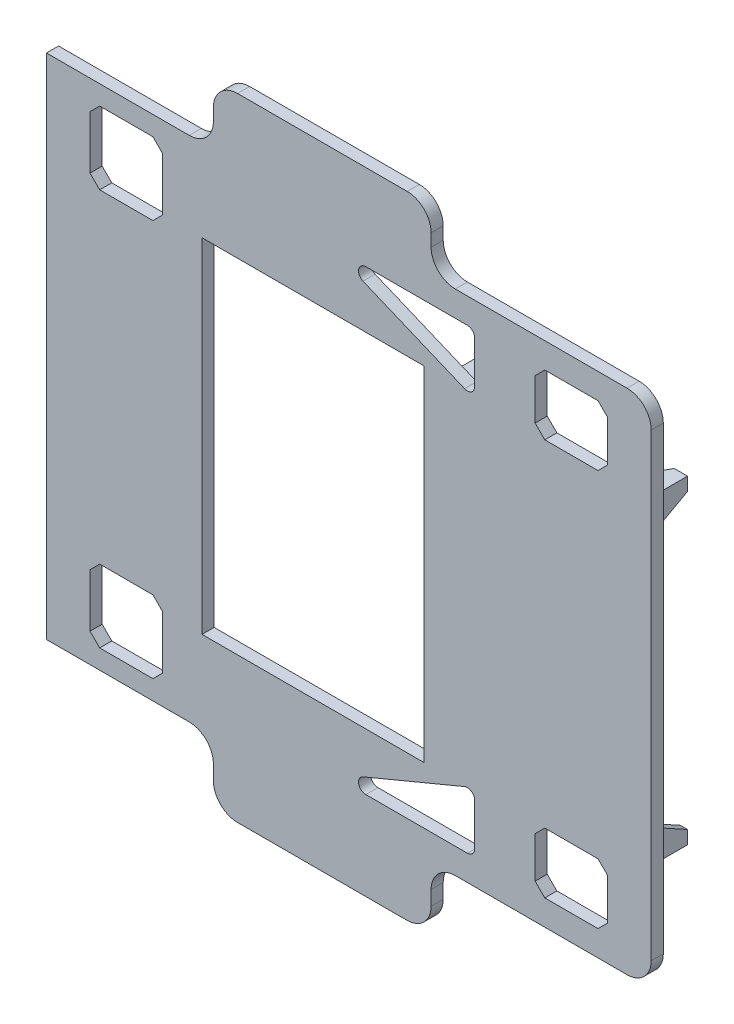
from build123d import *

# Parameters (mm, degrees)
EXTRUDE_1_DEPTH     = 5
SKETCH_2_W          = 30
SKETCH_2_H          = 30
SKETCH_2_H_2        = 25
CUT_EXTRUDE_1_DEPTH = 189.903823128
CHAMFER_1_SIZE      = 4
EXTRUDE_2_DEPTH     = 15
CUT_EXTRUDE_2_DEPTH = 3
CUT_EXTRUDE_3_DEPTH = 3
CUT_EXTRUDE_4_DEPTH = 3
CUT_EXTRUDE_5_DEPTH = 3
FILLET_1_R          = 3
SKETCH_8_W          = 91.7
SKETCH_8_H          = 142
CUT_EXTRUDE_6_DEPTH = 5


with BuildPart() as part:
    # 草图1 → 凸台-拉伸1 (new body)
    with BuildSketch(Plane.XY):
        with BuildLine():
            Line((-45, 115), (-45, 120))
            ThreePointArc((-45, 120), (-42.071067812, 127.071067812), (-35, 130))
            Line((-35, 130), (35.124730195, 130))
            ThreePointArc((35.124730195, 130), (42.10760044, 127.10760044), (45, 120.124730195))
            Line((45, 120.124730195), (45, 115))
            ThreePointArc((45, 115), (47.928932188, 107.928932188), (55, 105))
            Line((55, 105), (126, 105))
            ThreePointArc((126, 105), (133.071067812, 102.071067812), (136, 95))
            Line((136, 95), (136, -95))
            ThreePointArc((136, -95), (133.071067812, -102.071067812), (126, -105))
            Line((126, -105), (115, -105))
            Line((115, -105), (55, -105))
            ThreePointArc((55, -105), (47.928932188, -107.928932188), (45, -115))
            Line((45, -115), (45, -121.010130877))
            ThreePointArc((45, -121.010130877), (42.071067812, -128.081198689), (35, -131.010130877))
            Line((35, -131.010130877), (-35, -131.010130877))
            ThreePointArc((-35, -131.010130877), (-42.071067812, -128.081198689), (-45, -121.010130877))
            Line((-45, -121.010130877), (-45, -115))
            ThreePointArc((-45, -115), (-47.928932188, -107.928932188), (-55, -105))
            Line((-55, -105), (-114, -105))
            Line((-114, -105), (-114, -95))
            Line((-114, -95), (-114, 95))
            Line((-114, 95), (-114, 105))
            Line((-114, 105), (-55, 105))
            ThreePointArc((-55, 105), (-47.928932188, 107.928932188), (-45, 115))
        make_face()
    extrude(amount=EXTRUDE_1_DEPTH)

    # 草图2 → 切除-拉伸1 (cut, through all)
    with BuildSketch(Plane.XY.offset(5)):
        with Locations((-81, 82)):
            Rectangle(SKETCH_2_W, SKETCH_2_H)
        with Locations((-81, -82)):
            Rectangle(SKETCH_2_W, SKETCH_2_H)
        with Locations((103, 82)):
            Rectangle(SKETCH_2_W, SKETCH_2_H_2)
        with Locations((103, -82)):
            Rectangle(SKETCH_2_W, SKETCH_2_H_2)
        Polygon((3, 94.5), (63, 94.5), (63, 69.5), align=None)
        Polygon((3, -94.5), (63, -94.5), (63, -69.5), align=None)
    extrude(amount=-CUT_EXTRUDE_1_DEPTH, mode=Mode.SUBTRACT)

    # 倒角1
    chamfer_1_edges = [part.edges().sort_by_distance(p)[0] for p in [
        (118, -69.5, 2.5),
        (118, -94.5, 2.5),
        (88, -94.5, 2.5),
        (88, -69.5, 2.5),
        (118, 94.5, 2.5),
        (118, 69.5, 2.5),
        (88, 69.5, 2.5),
        (88, 94.5, 2.5),
        (-66, -67, 2.5),
        (-66, -97, 2.5),
        (-96, -97, 2.5),
        (-96, -67, 2.5),
        (-66, 97, 2.5),
        (-66, 67, 2.5),
        (-96, 67, 2.5),
        (-96, 97, 2.5),
    ]]
    chamfer(chamfer_1_edges, length=CHAMFER_1_SIZE)

    # 草图3 → 凸台-拉伸2 (add)
    with BuildSketch(Plane(origin=(0, 0, 0), x_dir=(-1, 0, 0), z_dir=(0, 0, -1))):
        Polygon((-131, 66), (-131, 55), (-128, 55), (-128, 63), (-120, 63), (-120, 66), align=None)
        Polygon((-56, 63), (-56, 66), (-45, 66), (-45, 55), (-48, 55), (-48, 63), align=None)
        Polygon((-48, -63), (-56, -63), (-56, -66), (-45, -66), (-45, -55), (-48, -55), align=None)
        Polygon((-120, -63), (-120, -66), (-131, -66), (-131, -55), (-128, -55), (-128, -63), align=None)
    extrude(amount=EXTRUDE_2_DEPTH)

    # 草图4 → 切除-拉伸2 (cut)
    with BuildSketch(Plane(origin=(131, 0, 0), x_dir=(0, 0, -1), z_dir=(1, 0, 0))):
        Polygon((15, 60.5), (5, 55), (15, 55), align=None)
        Polygon((15, -60.5), (15, -55), (5, -55), align=None)
    extrude(amount=-CUT_EXTRUDE_2_DEPTH, mode=Mode.SUBTRACT)

    # 草图5 → 切除-拉伸3 (cut)
    with BuildSketch(Plane(origin=(0, 66, 0), x_dir=(1, 0, 0), z_dir=(0, 1, 0))):
        Polygon((50.5, 15), (56, 15), (56, 5), align=None)
        Polygon((120, 15), (125.5, 15), (120, 5), align=None)
    extrude(amount=-CUT_EXTRUDE_3_DEPTH, mode=Mode.SUBTRACT)

    # 草图6 → 切除-拉伸4 (cut)
    with BuildSketch(Plane.ZY.offset(-45)):
        Polygon((-15, 60.5), (-5, 55), (-15, 55), align=None)
        Polygon((-15, -60.5), (-15, -55), (-5, -55), align=None)
    extrude(amount=-CUT_EXTRUDE_4_DEPTH, mode=Mode.SUBTRACT)

    # 草图7 → 切除-拉伸5 (cut)
    with BuildSketch(Plane.XZ.offset(66)):
        Polygon((50.5, -15), (56, -15), (56, -5), align=None)
        Polygon((120, -15), (125.5, -15), (120, -5), align=None)
    extrude(amount=-CUT_EXTRUDE_5_DEPTH, mode=Mode.SUBTRACT)

    # 圆角1
    fillet_1_edges = [part.edges().sort_by_distance(p)[0] for p in [
        (63, -69.5, 2.5),
        (63, -94.5, 2.5),
        (3, -94.5, 2.5),
        (63, 69.5, 2.5),
        (3, 94.5, 2.5),
        (63, 94.5, 2.5),
    ]]
    fillet(fillet_1_edges, radius=FILLET_1_R)

    # 草图8 → 切除-拉伸6 (cut)
    with BuildSketch(Plane(origin=(0, 0, 0), x_dir=(-1, 0, 0), z_dir=(0, 0, -1))):
        with Locations((3.85, 0)):
            Rectangle(SKETCH_8_W, SKETCH_8_H)
    extrude(amount=-CUT_EXTRUDE_6_DEPTH, mode=Mode.SUBTRACT)


solid = part.part
